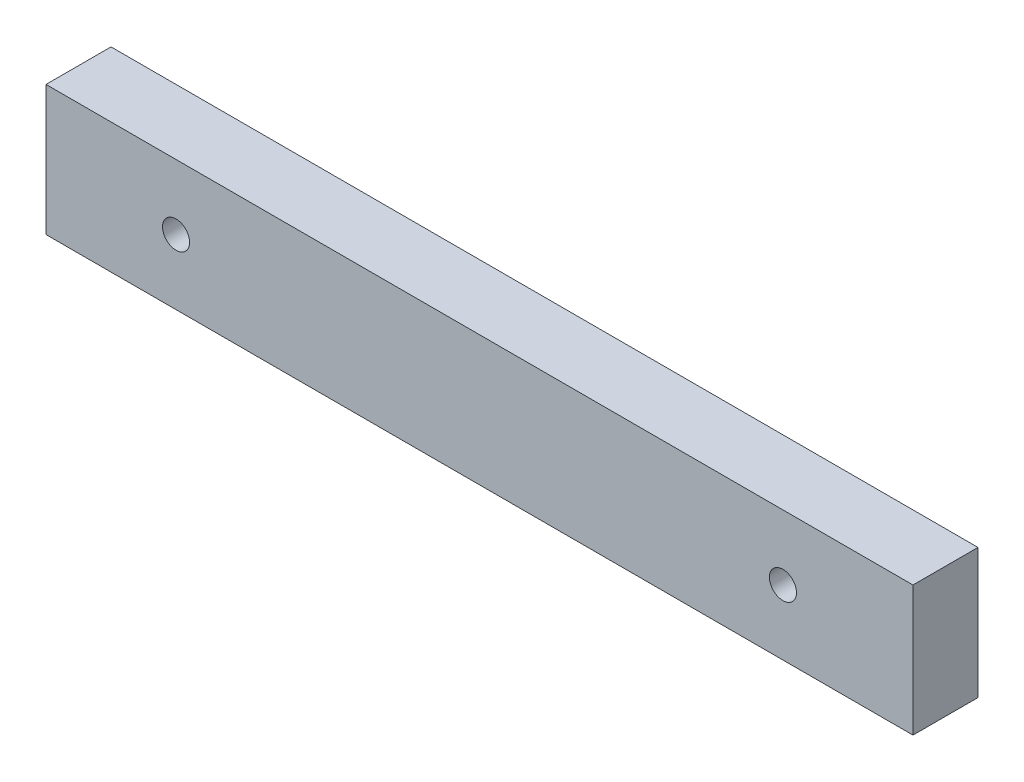
from build123d import *

# Parameters (mm, degrees)
BOSS_EXTRUDE2_DEPTH = 19.05


with BuildPart() as part:
    # Sketch1 → Boss-Extrude2 (new body)
    with BuildSketch(Plane.XY):
        with BuildLine():
            ThreePointArc((-20.820795526, 6.165281251), (-16.852045526, 10.134031251), (-12.883295526, 6.165281251))
            Line((-12.883295526, 6.165281251), (72.047954474, 6.165281251))
            Line((72.047954474, 6.165281251), (156.979204474, 6.165281251))
            ThreePointArc((156.979204474, 6.165281251), (160.947954474, 10.134031251), (164.916704474, 6.165281251))
            Line((164.916704474, 6.165281251), (199.047954474, 6.165281251))
            Line((199.047954474, 6.165281251), (199.047954474, 25.215281251))
            Line((199.047954474, 25.215281251), (-54.952045526, 25.215281251))
            Line((-54.952045526, 25.215281251), (-54.952045526, 6.165281251))
            Line((-54.952045526, 6.165281251), (-20.820795526, 6.165281251))
        make_face()
        with BuildLine():
            Line((72.047954474, 6.165281251), (-12.883295526, 6.165281251))
            ThreePointArc((-12.883295526, 6.165281251), (-16.852045526, 2.196531251), (-20.820795526, 6.165281251))
            Line((-20.820795526, 6.165281251), (-54.952045526, 6.165281251))
            Line((-54.952045526, 6.165281251), (-54.952045526, -12.884718749))
            Line((-54.952045526, -12.884718749), (199.047954474, -12.884718749))
            Line((199.047954474, -12.884718749), (199.047954474, 6.165281251))
            Line((199.047954474, 6.165281251), (164.916704474, 6.165281251))
            ThreePointArc((164.916704474, 6.165281251), (160.947954474, 2.196531251), (156.979204474, 6.165281251))
            Line((156.979204474, 6.165281251), (72.047954474, 6.165281251))
        make_face()
    extrude(amount=BOSS_EXTRUDE2_DEPTH)


solid = part.part
